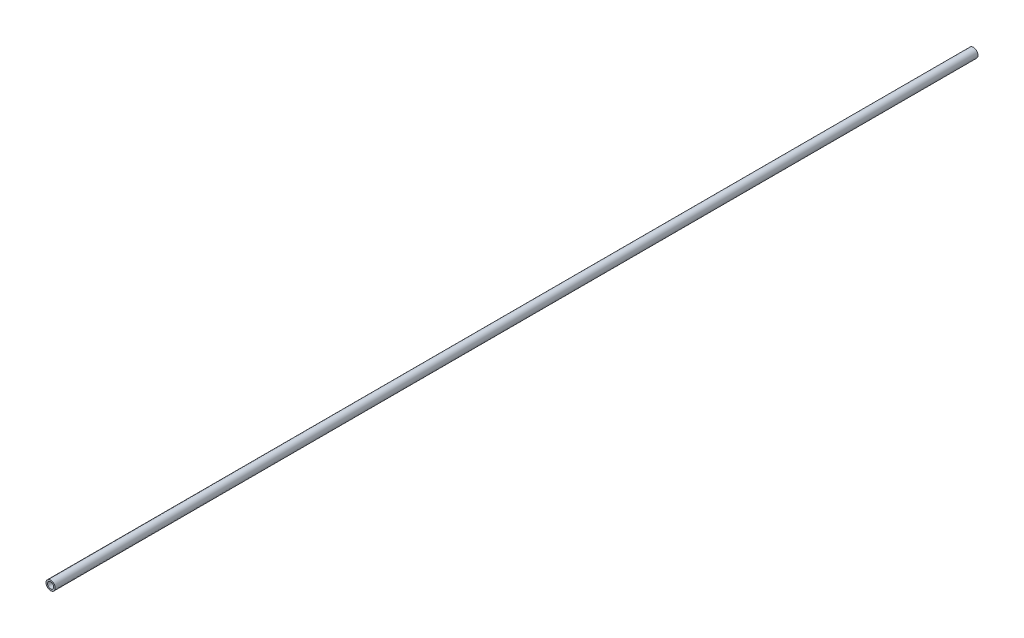
from build123d import *

# Parameters (mm, degrees)
SCHIZZO1_R                   = 3
SCHIZZO1_R_2                 = 2
ESTRUSIONE_ESTRUSIONE1_DEPTH = 600


with BuildPart() as part:
    # Schizzo1 → Estrusione-Estrusione1 (new body)
    with BuildSketch(Plane.XY):
        Circle(SCHIZZO1_R)
        Circle(SCHIZZO1_R_2, mode=Mode.SUBTRACT)
    extrude(amount=ESTRUSIONE_ESTRUSIONE1_DEPTH)


solid = part.part
